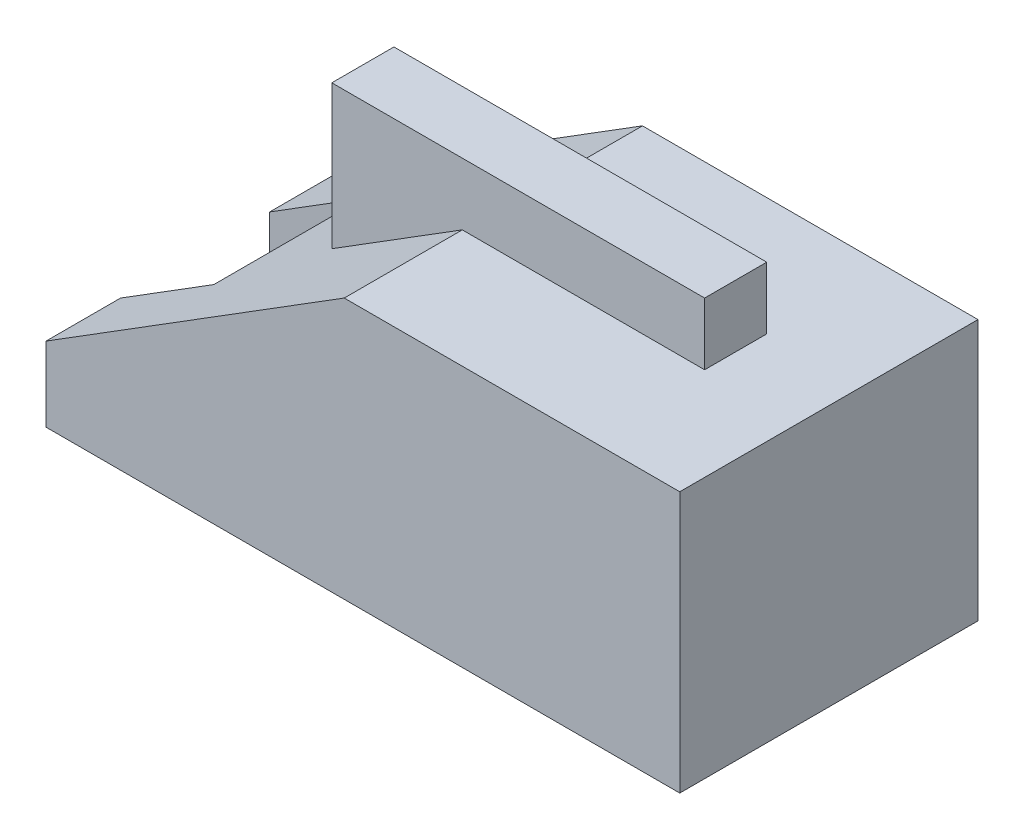
from build123d import *

# Parameters (mm, degrees)
BOSS_EXTRUDE1_DEPTH = 24
SKETCH2_W           = 60
SKETCH2_H           = 10
BOSS_EXTRUDE2_DEPTH = 52
CUT_EXTRUDE1_REACH  = 118.979
SKETCH3_W           = 15
SKETCH3_H           = 24


with BuildPart() as part:
    # Sketch1 → Boss-Extrude1 (new, symmetric)
    with BuildSketch(Plane.XY):
        Polygon((0, 0), (102, 0), (102, 42), (48, 42), (0, 12), align=None)
    extrude(amount=BOSS_EXTRUDE1_DEPTH, both=True)

    # Sketch2 → Boss-Extrude2 (add)
    with BuildSketch(Plane(origin=(0, 0, 0), x_dir=(1, 0, 0), z_dir=(0, 1, 0))):
        with Locations((57, 0)):
            Rectangle(SKETCH2_W, SKETCH2_H)
    extrude(amount=BOSS_EXTRUDE2_DEPTH)

    # Cut-Extrude1: up to this plane
    cut_extrude1_end = Plane(origin=(48, 42, 24), z_dir=(0.52999894000318, -0.8479983040050879, 0))
    # Sketch3 → Cut-Extrude1 (cut, up to the surface)
    with BuildSketch(Plane(origin=(0, 0, 0), x_dir=(1, 0, 0), z_dir=(0, 1, 0)), mode=Mode.PRIVATE) as cut_extrude1_sk1:
        with Locations((7.5, 0)):
            Rectangle(SKETCH3_W, SKETCH3_H)
    cut_extrude1_tool1 = split(extrude(cut_extrude1_sk1.sketch, amount=CUT_EXTRUDE1_REACH, mode=Mode.PRIVATE), bisect_by=cut_extrude1_end, keep=Keep.BOTH, mode=Mode.PRIVATE)
    add(cut_extrude1_tool1.solids().sort_by_distance((7.5, 0, 0))[0], mode=Mode.SUBTRACT)


solid = part.part
